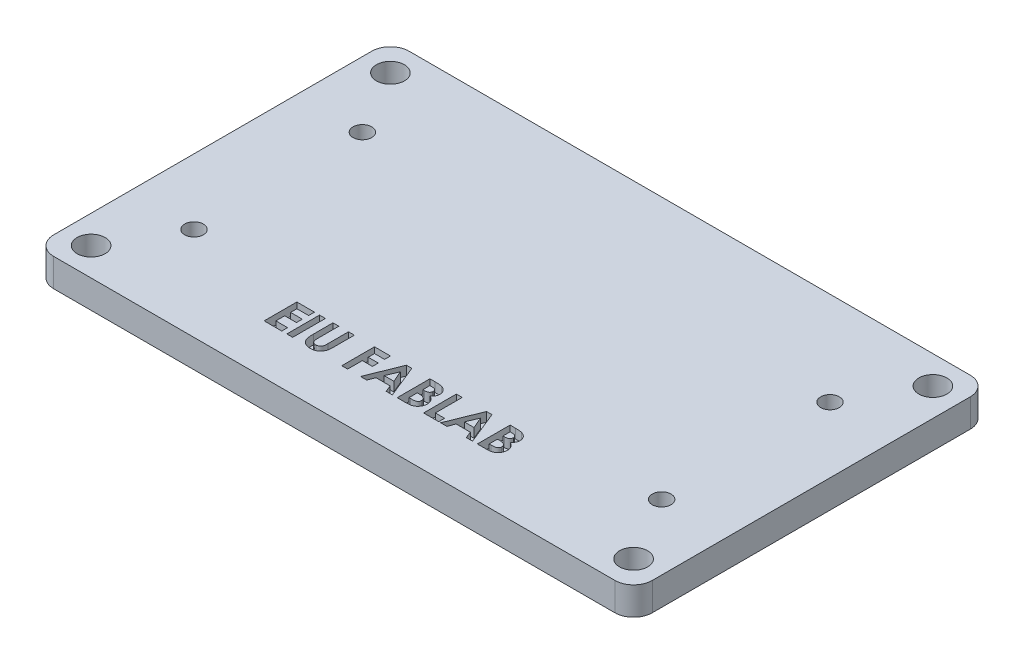
from build123d import *

# Parameters (mm, degrees)
SKETCH1_R           = 1.5
SKETCH1_R_2         = 1
BOSS_EXTRUDE1_DEPTH = 3
SKETCH2_W           = 0.628205128
SKETCH2_H           = 3.5
CUT_EXTRUDE3_DEPTH  = 1


with BuildPart() as part:
    # Sketch1 → Boss-Extrude1 (new body)
    with BuildSketch(Plane(origin=(0, 0, 0), x_dir=(1, 0, 0), z_dir=(0, 1, 0))):
        with BuildLine():
            Line((-30, -19), (30, -19))
            ThreePointArc((30, -19), (31.414213562, -18.414213562), (32, -17))
            Line((32, -17), (32, 17))
            ThreePointArc((32, 17), (31.414213562, 18.414213562), (30, 19))
            Line((30, 19), (-30, 19))
            ThreePointArc((-30, 19), (-31.414213562, 18.414213562), (-32, 17))
            Line((-32, 17), (-32, -17))
            ThreePointArc((-32, -17), (-31.414213562, -18.414213562), (-30, -19))
        make_face()
        with Locations(Location((-29, 16, 0), (0, 0, 270))):
            Circle(SKETCH1_R, mode=Mode.SUBTRACT)
        with Locations(Location((29, 16, 0), (0, 0, 270))):
            Circle(SKETCH1_R, mode=Mode.SUBTRACT)
        with Locations(Location((-29, -16, 0), (0, 0, 270))):
            Circle(SKETCH1_R, mode=Mode.SUBTRACT)
        with Locations(Location((29, -16, 0), (0, 0, 270))):
            Circle(SKETCH1_R, mode=Mode.SUBTRACT)
        with Locations(Location((-25, 9, 0), (0, 0, 270))):
            Circle(SKETCH1_R_2, mode=Mode.SUBTRACT)
        with Locations(Location((-25, -9, 0), (0, 0, 270))):
            Circle(SKETCH1_R_2, mode=Mode.SUBTRACT)
        with Locations(Location((25, -9, 0), (0, 0, 270))):
            Circle(SKETCH1_R_2, mode=Mode.SUBTRACT)
        with Locations(Location((25, 9, 0), (0, 0, 270))):
            Circle(SKETCH1_R_2, mode=Mode.SUBTRACT)
    extrude(amount=BOSS_EXTRUDE1_DEPTH)

    # Sketch2 → Cut-Extrude3 (cut)
    # profile 1 of 9: a face of its own
    with BuildSketch(Plane(origin=(0, 3, 0), x_dir=(1, 0, 0), z_dir=(0, 1, 0))):
        Polygon((-12.780618799, -10.2198596), (-10.896003415, -10.2198596), (-10.896003415, -10.848064728), (-12.152413671, -10.848064728), (-12.152413671, -11.521141651), (-10.896003415, -11.521141651), (-10.896003415, -12.149346779), (-12.152413671, -12.149346779), (-12.152413671, -13.091654471), (-10.896003415, -13.091654471), (-10.896003415, -13.7198596), (-12.780618799, -13.7198596), align=None)
    # profile 2 of 9: a face of its own
    with BuildSketch(Plane(origin=(0, 3, 0), x_dir=(1, 0, 0), z_dir=(0, 1, 0))):
        with Locations((-10.043439312, -11.9698596)):
            Rectangle(SKETCH2_W, SKETCH2_H)
    # profile 3 of 9: a face of its own
    with BuildSketch(Plane(origin=(0, 3, 0), x_dir=(1, 0, 0), z_dir=(0, 1, 0))):
        with BuildLine():
            Line((-8.92164444, -10.2198596), (-8.293439312, -10.2198596))
            Line((-8.293439312, -10.2198596), (-8.293439312, -12.497103189))
            add(Edge.make_bspline(
                [(-8.293439312, -12.497103189), (-8.293405153, -12.520712663), (-8.293339176, -12.566314118), (-8.290036325, -12.631737275), (-8.287013988, -12.691874855), (-8.281560834, -12.74666102), (-8.273504657, -12.796119204), (-8.265703649, -12.840567111), (-8.255145756, -12.87920895), (-8.239278931, -12.92319348), (-8.214833362, -12.972612501), (-8.174890659, -13.024118139), (-8.128800196, -13.07112451), (-8.073558122, -13.110250831), (-8.011470916, -13.141900499), (-7.942879721, -13.1653494), (-7.867881224, -13.178383876), (-7.816023877, -13.180373827), (-7.789332741, -13.181398061)],
                knots=[0, 0, 0, 0, 1.155499968, 2.231836252, 3.205919964, 4.102923608, 4.924856345, 5.658536265, 6.31071849, 6.882491295, 7.94666036, 8.992281882, 10.060072772, 11.158554251, 12.289267114, 13.461410017, 14.693379945, 16, 16, 16, 16], degree=3))
            add(Edge.make_bspline(
                [(-7.789332741, -13.181398061), (-7.760976704, -13.180570611), (-7.705687231, -13.178957225), (-7.626162127, -13.163120087), (-7.552481667, -13.137901939), (-7.486205918, -13.101909216), (-7.427400834, -13.058765629), (-7.377623563, -13.00956842), (-7.338339524, -12.954219465), (-7.312735648, -12.903155839), (-7.298360333, -12.856156218), (-7.287585319, -12.81416384), (-7.279686041, -12.764616991), (-7.272519556, -12.708289452), (-7.268213051, -12.644597777), (-7.263543348, -12.574054184), (-7.261831859, -12.496175993), (-7.261540148, -12.441947948), (-7.26138803, -12.413669696)],
                knots=[0, 0, 0, 0, 1.261321664, 2.459363699, 3.594844139, 4.716940403, 5.803436589, 6.833651888, 7.818396249, 8.814403945, 9.360733334, 10.004355033, 10.743453831, 11.592799886, 12.532235708, 13.585170094, 14.740740724, 16, 16, 16, 16], degree=3))
            Line((-7.26138803, -12.413669696), (-7.26138803, -10.2198596))
            Line((-7.26138803, -10.2198596), (-6.633182902, -10.2198596))
            Line((-6.633182902, -10.2198596), (-6.633182902, -12.307800305))
            add(Edge.make_bspline(
                [(-6.633182902, -12.307800305), (-6.633270139, -12.350101884), (-6.633437889, -12.431443694), (-6.636014017, -12.5483376), (-6.641498127, -12.655101433), (-6.646104148, -12.751766388), (-6.655018374, -12.838202243), (-6.664304907, -12.914778102), (-6.676141392, -12.981222598), (-6.69375337, -13.056861582), (-6.72414643, -13.143957102), (-6.773144027, -13.244243818), (-6.835343305, -13.342430587), (-6.908859744, -13.437437288), (-6.991866528, -13.525695451), (-7.082523219, -13.603174695), (-7.179389508, -13.66871378), (-7.283477578, -13.720710197), (-7.394698845, -13.761263483), (-7.51415376, -13.788513248), (-7.641760865, -13.806923531), (-7.729901504, -13.808692066), (-7.775310306, -13.809603189)],
                knots=[0, 0, 0, 0, 1.170808336, 2.251350247, 3.235597562, 4.129743112, 4.929140599, 5.639994148, 6.264258765, 6.79612947, 7.788252245, 8.809469599, 9.879094798, 10.999557536, 12.129761673, 13.226370002, 14.293821979, 15.358369427, 16.438775801, 17.562147481, 18.744053101, 20, 20, 20, 20], degree=3))
            add(Edge.make_bspline(
                [(-7.775310306, -13.809603189), (-7.805480817, -13.809095007), (-7.865006617, -13.808092373), (-7.952549749, -13.799251765), (-8.037177382, -13.786224033), (-8.118730503, -13.767217912), (-8.197492166, -13.742665555), (-8.273441447, -13.712443313), (-8.3462961, -13.676719762), (-8.415648441, -13.635823482), (-8.481413125, -13.591601195), (-8.541518651, -13.542578928), (-8.598033392, -13.492382063), (-8.64932466, -13.438898103), (-8.695777699, -13.382688539), (-8.737296839, -13.32362598), (-8.773820395, -13.261715674), (-8.806267098, -13.19584169), (-8.834038309, -13.122655892), (-8.857450483, -13.03955503), (-8.87790391, -12.945236582), (-8.893103689, -12.839488054), (-8.906883899, -12.72265798), (-8.915606012, -12.594442001), (-8.920168941, -12.454836437), (-8.92114018, -12.358050794), (-8.92164444, -12.307800305)],
                knots=[0, 0, 0, 0, 1.001158378, 1.975264943, 2.917723546, 3.841610987, 4.75185031, 5.653588123, 6.552117133, 7.442167995, 8.324307438, 9.179605724, 10.014504199, 10.831958861, 11.636465792, 12.43274043, 13.225645099, 14.020104002, 14.867201867, 15.819789774, 16.883317127, 18.068162734, 19.364263498, 20.787406516, 22.332041935, 24, 24, 24, 24], degree=3))
            Line((-8.92164444, -12.307800305), (-8.92164444, -10.2198596))
        make_face()
    # profile 4 of 9: a face of its own
    with BuildSketch(Plane(origin=(0, 3, 0), x_dir=(1, 0, 0), z_dir=(0, 1, 0))):
        Polygon((-4.479336748, -10.2198596), (-2.774208543, -10.2198596), (-2.774208543, -10.848064728), (-3.85113162, -10.848064728), (-3.85113162, -11.521141651), (-2.774208543, -11.521141651), (-2.774208543, -12.149346779), (-3.85113162, -12.149346779), (-3.85113162, -13.7198596), (-4.479336748, -13.7198596), align=None)
    # profile 5 of 9: a face of its own
    with BuildSketch(Plane(origin=(0, 3, 0), x_dir=(1, 0, 0), z_dir=(0, 1, 0))):
        Polygon((-1.069781459, -10.2198596), (-0.485747004, -10.2198596), (0.927714534, -13.7198596), (0.256740976, -13.7198596), (-0.01529428, -13.001910882), (-1.53883194, -13.001910882), (-1.811568318, -13.7198596), (-2.482541876, -13.7198596), align=None)
        Polygon((-0.777413671, -11.158661683), (-1.30045053, -12.373705753), (-0.25367569, -12.373705753), align=None, mode=Mode.SUBTRACT)
    # profile 6 of 9: a face of its own
    with BuildSketch(Plane(origin=(0, 3, 0), x_dir=(1, 0, 0), z_dir=(0, 1, 0))):
        with BuildLine():
            Line((1.443740175, -13.7198596), (1.443740175, -10.2198596))
            Line((1.443740175, -10.2198596), (2.004637611, -10.2198596))
            add(Edge.make_bspline(
                [(2.004637611, -10.2198596), (2.043903939, -10.219855118), (2.119883538, -10.219846447), (2.229502272, -10.223695897), (2.331164389, -10.228675592), (2.424546363, -10.234246713), (2.509807135, -10.243846866), (2.586817053, -10.25396438), (2.655729982, -10.266165477), (2.698335102, -10.27711024), (2.718379598, -10.282259439)],
                knots=[0, 0, 0, 0, 1.311965854, 2.538629056, 3.664479157, 4.713267157, 5.663616078, 6.530575999, 7.308677837, 8, 8, 8, 8], degree=3))
            add(Edge.make_bspline(
                [(2.718379598, -10.282259439), (2.744700057, -10.289522477), (2.796349246, -10.303774887), (2.870327367, -10.332558247), (2.940505934, -10.364552991), (3.006799261, -10.401053011), (3.068800281, -10.442498963), (3.126273369, -10.489219776), (3.180458076, -10.539340077), (3.229430428, -10.594256705), (3.273693365, -10.652286296), (3.312149922, -10.713413643), (3.345563741, -10.776704071), (3.372303548, -10.842954046), (3.39245149, -10.91185847), (3.407187611, -10.98312311), (3.416738613, -11.056973465), (3.417641057, -11.107216275), (3.41809915, -11.132720176)],
                knots=[0, 0, 0, 0, 1.099996261, 2.158545794, 3.195537121, 4.207578794, 5.205712374, 6.197378256, 7.190519799, 8.17788031, 9.159561366, 10.129234751, 11.085776129, 12.040971148, 13.00380137, 13.975669004, 14.972423361, 16, 16, 16, 16], degree=3))
            add(Edge.make_bspline(
                [(3.41809915, -11.132720176), (3.416901374, -11.165485995), (3.4145437, -11.229981484), (3.399482715, -11.324713689), (3.371241023, -11.414249238), (3.334287456, -11.500238239), (3.284042159, -11.582359951), (3.220240348, -11.660575329), (3.143915404, -11.73729274), (3.085369959, -11.783279654), (3.05491806, -11.807199343)],
                knots=[0, 0, 0, 0, 0.986156485, 1.941127874, 2.875419072, 3.804401753, 4.751181392, 5.761612777, 6.835722519, 8, 8, 8, 8], degree=3))
            add(Edge.make_bspline(
                [(3.05491806, -11.807199343), (3.079594818, -11.819796614), (3.127979115, -11.844496378), (3.196670601, -11.885095416), (3.260271419, -11.928277643), (3.319066736, -11.973174213), (3.371823252, -12.021688358), (3.420719373, -12.071024627), (3.463342817, -12.124009781), (3.501457986, -12.178755331), (3.534587071, -12.236053996), (3.563438851, -12.295809013), (3.587808915, -12.358224518), (3.608446115, -12.422982867), (3.623837344, -12.490306797), (3.633872753, -12.560220388), (3.64155649, -12.632485197), (3.642154212, -12.68171018), (3.642458124, -12.706738606)],
                knots=[0, 0, 0, 0, 1.164658916, 2.283573913, 3.35186032, 4.395461096, 5.390182219, 6.362969632, 7.312859996, 8.245001507, 9.165155236, 10.092416118, 11.032087915, 11.979892451, 12.947605196, 13.931445124, 14.948243989, 16, 16, 16, 16], degree=3))
            add(Edge.make_bspline(
                [(3.642458124, -12.706738606), (3.64048594, -12.754541468), (3.636593842, -12.848880225), (3.608136721, -12.987391186), (3.558801116, -13.118712141), (3.492553571, -13.242321162), (3.41092385, -13.354639973), (3.31707308, -13.453030276), (3.211946122, -13.536315483), (3.114953797, -13.592526537), (3.031063074, -13.630249411), (2.961577956, -13.65357207), (2.886952412, -13.675178146), (2.805819481, -13.690350379), (2.719649993, -13.704237675), (2.62760379, -13.712811979), (2.529852904, -13.718622574), (2.46271337, -13.719438921), (2.428115175, -13.7198596)],
                knots=[0, 0, 0, 0, 1.284142165, 2.534249414, 3.780121997, 5.041676246, 6.291546858, 7.49970053, 8.684500223, 9.883330709, 10.50184324, 11.153274765, 11.851151195, 12.587658647, 13.369265475, 14.195992086, 15.070362669, 16, 16, 16, 16], degree=3))
            Line((2.428115175, -13.7198596), (1.443740175, -13.7198596))
        make_face()
        with BuildLine():
            Line((2.071945303, -10.848064728), (2.071945303, -11.610885241))
            Line((2.071945303, -11.610885241), (2.238812291, -11.610885241))
            add(Edge.make_bspline(
                [(2.238812291, -11.610885241), (2.261491013, -11.610687474), (2.305270915, -11.610305696), (2.36850634, -11.605388537), (2.427305072, -11.596999558), (2.481444102, -11.585294822), (2.531427754, -11.570431514), (2.576936717, -11.552547753), (2.617770898, -11.530727621), (2.665210772, -11.498225572), (2.71535814, -11.450397351), (2.759502304, -11.381299577), (2.785502922, -11.301837399), (2.788398689, -11.245794519), (2.789894021, -11.216854792)],
                knots=[0, 0, 0, 0, 1.065314748, 2.056525647, 2.977365736, 3.853934255, 4.656397591, 5.425096493, 6.14721249, 6.826394842, 8.123232004, 9.372140726, 10.643011755, 12, 12, 12, 12], degree=3))
            add(Edge.make_bspline(
                [(2.789894021, -11.216854792), (2.788697482, -11.189747929), (2.786384021, -11.1373379), (2.760204742, -11.06374955), (2.719543146, -10.998535212), (2.671536416, -10.953901331), (2.626328752, -10.923417706), (2.587619176, -10.903345537), (2.54513251, -10.885377137), (2.498046256, -10.87163806), (2.446629304, -10.86132874), (2.391131415, -10.85375778), (2.331456835, -10.848604662), (2.290239476, -10.848248566), (2.268960528, -10.848064728)],
                knots=[0, 0, 0, 0, 1.347982417, 2.606269829, 3.849316587, 5.153353503, 5.842674298, 6.568177932, 7.326619318, 8.142485038, 9.012069166, 9.942760135, 10.937925643, 12, 12, 12, 12], degree=3))
            Line((2.268960528, -10.848064728), (2.071945303, -10.848064728))
        make_face(mode=Mode.SUBTRACT)
        with BuildLine():
            Line((2.071945303, -12.194218574), (2.071945303, -13.091654471))
            Line((2.071945303, -13.091654471), (2.252834726, -13.091654471))
            add(Edge.make_bspline(
                [(2.252834726, -13.091654471), (2.288596796, -13.091450164), (2.357353836, -13.091057358), (2.455848175, -13.086311322), (2.545404153, -13.077757429), (2.62578448, -13.067078583), (2.697112274, -13.052610416), (2.75914643, -13.034215996), (2.812737665, -13.013978931), (2.857564645, -12.988983752), (2.894185719, -12.959895563), (2.927232399, -12.930166735), (2.954176603, -12.895871722), (2.97549536, -12.858482716), (2.993946706, -12.818928486), (3.005075256, -12.775664453), (3.013548142, -12.72997286), (3.014014428, -12.698368973), (3.014252996, -12.682199343)],
                knots=[0, 0, 0, 0, 1.753078804, 3.370512758, 4.83203934, 6.162291463, 7.344201807, 8.395507345, 9.331626367, 10.147333109, 10.898971645, 11.62040215, 12.321813352, 13.025280112, 13.727906689, 14.453419512, 15.208716525, 16, 16, 16, 16], degree=3))
            add(Edge.make_bspline(
                [(3.014252996, -12.682199343), (3.013726886, -12.663709117), (3.012702164, -12.627695132), (3.004333254, -12.575056849), (2.989124211, -12.525915519), (2.969967679, -12.479014532), (2.943310347, -12.436033107), (2.911629018, -12.39548382), (2.873349886, -12.358739794), (2.830302768, -12.323578615), (2.780092567, -12.292793097), (2.722695726, -12.266081208), (2.657800434, -12.243772421), (2.58520567, -12.226010151), (2.505229685, -12.210935557), (2.417288742, -12.201934361), (2.322115243, -12.195239775), (2.25612039, -12.194566709), (2.221985368, -12.194218574)],
                knots=[0, 0, 0, 0, 0.845221588, 1.646264278, 2.427170338, 3.19324141, 3.95557735, 4.731569926, 5.540061037, 6.376114724, 7.268642756, 8.224665384, 9.265483498, 10.400594375, 11.639216012, 12.983232105, 14.439614077, 16, 16, 16, 16], degree=3))
            Line((2.221985368, -12.194218574), (2.071945303, -12.194218574))
        make_face(mode=Mode.SUBTRACT)
    # profile 7 of 9: a face of its own
    with BuildSketch(Plane(origin=(0, 3, 0), x_dir=(1, 0, 0), z_dir=(0, 1, 0))):
        Polygon((4.270663252, -10.2198596), (4.89886838, -10.2198596), (4.89886838, -13.091654471), (5.886047868, -13.091654471), (5.886047868, -13.7198596), (4.270663252, -13.7198596), align=None)
    # profile 8 of 9: a face of its own
    with BuildSketch(Plane(origin=(0, 3, 0), x_dir=(1, 0, 0), z_dir=(0, 1, 0))):
        Polygon((7.500731361, -10.2198596), (8.084765816, -10.2198596), (9.498227355, -13.7198596), (8.827253797, -13.7198596), (8.555218541, -13.001910882), (7.03168088, -13.001910882), (6.758944502, -13.7198596), (6.087970944, -13.7198596), align=None)
        Polygon((7.79309915, -11.158661683), (7.270062291, -12.373705753), (8.31683713, -12.373705753), align=None, mode=Mode.SUBTRACT)
    # profile 9 of 9: a face of its own
    with BuildSketch(Plane(origin=(0, 3, 0), x_dir=(1, 0, 0), z_dir=(0, 1, 0))):
        with BuildLine():
            Line((10.014252996, -13.7198596), (10.014252996, -10.2198596))
            Line((10.014252996, -10.2198596), (10.575150432, -10.2198596))
            add(Edge.make_bspline(
                [(10.575150432, -10.2198596), (10.614416759, -10.219855118), (10.690396359, -10.219846447), (10.800015092, -10.223695897), (10.90167721, -10.228675592), (10.995059183, -10.234246713), (11.080319955, -10.243846866), (11.157329873, -10.25396438), (11.226242803, -10.266165477), (11.268847923, -10.27711024), (11.288892419, -10.282259439)],
                knots=[0, 0, 0, 0, 1.311965854, 2.538629056, 3.664479157, 4.713267157, 5.663616078, 6.530575999, 7.308677837, 8, 8, 8, 8], degree=3))
            add(Edge.make_bspline(
                [(11.288892419, -10.282259439), (11.315212877, -10.289522477), (11.366862066, -10.303774887), (11.440840187, -10.332558247), (11.511018755, -10.364552991), (11.577312082, -10.401053011), (11.639313102, -10.442498963), (11.696786189, -10.489219776), (11.750970896, -10.539340077), (11.799943248, -10.594256705), (11.844206186, -10.652286296), (11.882662742, -10.713413643), (11.916076561, -10.776704071), (11.942816368, -10.842954046), (11.96296431, -10.91185847), (11.977700431, -10.98312311), (11.987251433, -11.056973465), (11.988153878, -11.107216275), (11.98861197, -11.132720176)],
                knots=[0, 0, 0, 0, 1.099996261, 2.158545794, 3.195537121, 4.207578794, 5.205712374, 6.197378256, 7.190519799, 8.17788031, 9.159561366, 10.129234751, 11.085776129, 12.040971148, 13.00380137, 13.975669004, 14.972423361, 16, 16, 16, 16], degree=3))
            add(Edge.make_bspline(
                [(11.98861197, -11.132720176), (11.987414194, -11.165485995), (11.98505652, -11.229981484), (11.969995536, -11.324713689), (11.941753844, -11.414249238), (11.904800277, -11.500238239), (11.854554979, -11.582359951), (11.790753168, -11.660575329), (11.714428225, -11.73729274), (11.65588278, -11.783279654), (11.62543088, -11.807199343)],
                knots=[0, 0, 0, 0, 0.986156485, 1.941127874, 2.875419072, 3.804401753, 4.751181392, 5.761612777, 6.835722519, 8, 8, 8, 8], degree=3))
            add(Edge.make_bspline(
                [(11.62543088, -11.807199343), (11.650107639, -11.819796614), (11.698491935, -11.844496378), (11.767183422, -11.885095416), (11.83078424, -11.928277643), (11.889579556, -11.973174213), (11.942336073, -12.021688358), (11.991232193, -12.071024627), (12.033855638, -12.124009781), (12.071970807, -12.178755331), (12.105099892, -12.236053996), (12.133951672, -12.295809013), (12.158321735, -12.358224518), (12.178958936, -12.422982867), (12.194350165, -12.490306797), (12.204385574, -12.560220388), (12.21206931, -12.632485197), (12.212667033, -12.68171018), (12.212970944, -12.706738606)],
                knots=[0, 0, 0, 0, 1.164658916, 2.283573913, 3.35186032, 4.395461096, 5.390182219, 6.362969632, 7.312859996, 8.245001507, 9.165155236, 10.092416118, 11.032087915, 11.979892451, 12.947605196, 13.931445124, 14.948243989, 16, 16, 16, 16], degree=3))
            add(Edge.make_bspline(
                [(12.212970944, -12.706738606), (12.21099876, -12.754541468), (12.207106662, -12.848880225), (12.178649541, -12.987391186), (12.129313936, -13.118712141), (12.063066392, -13.242321162), (11.981436671, -13.354639973), (11.8875859, -13.453030276), (11.782458942, -13.536315483), (11.685466618, -13.592526537), (11.601575895, -13.630249411), (11.532090776, -13.65357207), (11.457465232, -13.675178146), (11.376332301, -13.690350379), (11.290162813, -13.704237675), (11.19811661, -13.712811979), (11.100365724, -13.718622574), (11.03322619, -13.719438921), (10.998627996, -13.7198596)],
                knots=[0, 0, 0, 0, 1.284142165, 2.534249414, 3.780121997, 5.041676246, 6.291546858, 7.49970053, 8.684500223, 9.883330709, 10.50184324, 11.153274765, 11.851151195, 12.587658647, 13.369265475, 14.195992086, 15.070362669, 16, 16, 16, 16], degree=3))
            Line((10.998627996, -13.7198596), (10.014252996, -13.7198596))
        make_face()
        with BuildLine():
            Line((10.642458124, -10.848064728), (10.642458124, -11.610885241))
            Line((10.642458124, -11.610885241), (10.809325111, -11.610885241))
            add(Edge.make_bspline(
                [(10.809325111, -11.610885241), (10.832003834, -11.610687474), (10.875783736, -11.610305696), (10.93901916, -11.605388537), (10.997817893, -11.596999558), (11.051956922, -11.585294822), (11.101940574, -11.570431514), (11.147449538, -11.552547753), (11.188283719, -11.530727621), (11.235723593, -11.498225572), (11.285870961, -11.450397351), (11.330015124, -11.381299577), (11.356015742, -11.301837399), (11.35891151, -11.245794519), (11.360406842, -11.216854792)],
                knots=[0, 0, 0, 0, 1.065314748, 2.056525647, 2.977365736, 3.853934255, 4.656397591, 5.425096493, 6.14721249, 6.826394842, 8.123232004, 9.372140726, 10.643011755, 12, 12, 12, 12], degree=3))
            add(Edge.make_bspline(
                [(11.360406842, -11.216854792), (11.359210302, -11.189747929), (11.356896841, -11.1373379), (11.330717562, -11.06374955), (11.290055966, -10.998535212), (11.242049237, -10.953901331), (11.196841573, -10.923417706), (11.158131997, -10.903345537), (11.11564533, -10.885377137), (11.068559077, -10.87163806), (11.017142125, -10.86132874), (10.961644236, -10.85375778), (10.901969656, -10.848604662), (10.860752296, -10.848248566), (10.839473348, -10.848064728)],
                knots=[0, 0, 0, 0, 1.347982417, 2.606269829, 3.849316587, 5.153353503, 5.842674298, 6.568177932, 7.326619318, 8.142485038, 9.012069166, 9.942760135, 10.937925643, 12, 12, 12, 12], degree=3))
            Line((10.839473348, -10.848064728), (10.642458124, -10.848064728))
        make_face(mode=Mode.SUBTRACT)
        with BuildLine():
            Line((10.642458124, -12.194218574), (10.642458124, -13.091654471))
            Line((10.642458124, -13.091654471), (10.823347547, -13.091654471))
            add(Edge.make_bspline(
                [(10.823347547, -13.091654471), (10.859109616, -13.091450164), (10.927866657, -13.091057358), (11.026360996, -13.086311322), (11.115916974, -13.077757429), (11.196297301, -13.067078583), (11.267625094, -13.052610416), (11.32965925, -13.034215996), (11.383250486, -13.013978931), (11.428077465, -12.988983752), (11.46469854, -12.959895563), (11.49774522, -12.930166735), (11.524689424, -12.895871722), (11.546008181, -12.858482716), (11.564459527, -12.818928486), (11.575588076, -12.775664453), (11.584060963, -12.72997286), (11.584527249, -12.698368973), (11.584765816, -12.682199343)],
                knots=[0, 0, 0, 0, 1.753078804, 3.370512758, 4.83203934, 6.162291463, 7.344201807, 8.395507345, 9.331626367, 10.147333109, 10.898971645, 11.62040215, 12.321813352, 13.025280112, 13.727906689, 14.453419512, 15.208716525, 16, 16, 16, 16], degree=3))
            add(Edge.make_bspline(
                [(11.584765816, -12.682199343), (11.584239706, -12.663709117), (11.583214985, -12.627695132), (11.574846075, -12.575056849), (11.559637032, -12.525915519), (11.540480499, -12.479014532), (11.513823167, -12.436033107), (11.482141839, -12.39548382), (11.443862706, -12.358739794), (11.400815589, -12.323578615), (11.350605388, -12.292793097), (11.293208547, -12.266081208), (11.228313254, -12.243772421), (11.155718491, -12.226010151), (11.075742506, -12.210935557), (10.987801562, -12.201934361), (10.892628063, -12.195239775), (10.82663321, -12.194566709), (10.792498188, -12.194218574)],
                knots=[0, 0, 0, 0, 0.845221588, 1.646264278, 2.427170338, 3.19324141, 3.95557735, 4.731569926, 5.540061037, 6.376114724, 7.268642756, 8.224665384, 9.265483498, 10.400594375, 11.639216012, 12.983232105, 14.439614077, 16, 16, 16, 16], degree=3))
            Line((10.792498188, -12.194218574), (10.642458124, -12.194218574))
        make_face(mode=Mode.SUBTRACT)
    extrude(amount=-CUT_EXTRUDE3_DEPTH, mode=Mode.SUBTRACT)


solid = part.part
